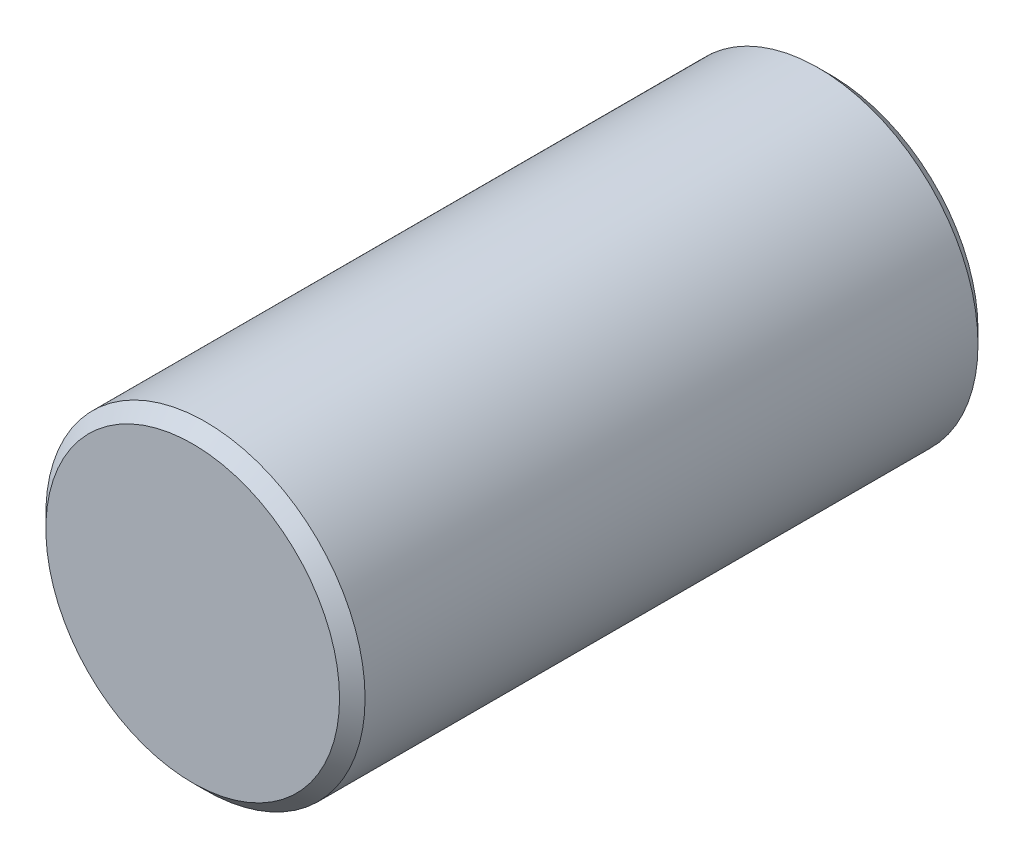
from build123d import *

# Parameters (mm, degrees)
SKETCH2_R           = 1.25
BOSS_EXTRUDE1_DEPTH = 2.5
CHAMFER1_SIZE       = 0.1


with BuildPart() as part:
    # Sketch2 → Boss-Extrude1 (new, symmetric)
    with BuildSketch(Plane.XY):
        Circle(SKETCH2_R)
    extrude(amount=BOSS_EXTRUDE1_DEPTH, both=True)

    # Chamfer1
    chamfer1_edges = [part.edges().sort_by_distance(p)[0] for p in [
        (-1.25, 0, -2.5),
        (-1.25, 0, 2.5),
    ]]
    chamfer(chamfer1_edges, length=CHAMFER1_SIZE)


solid = part.part
